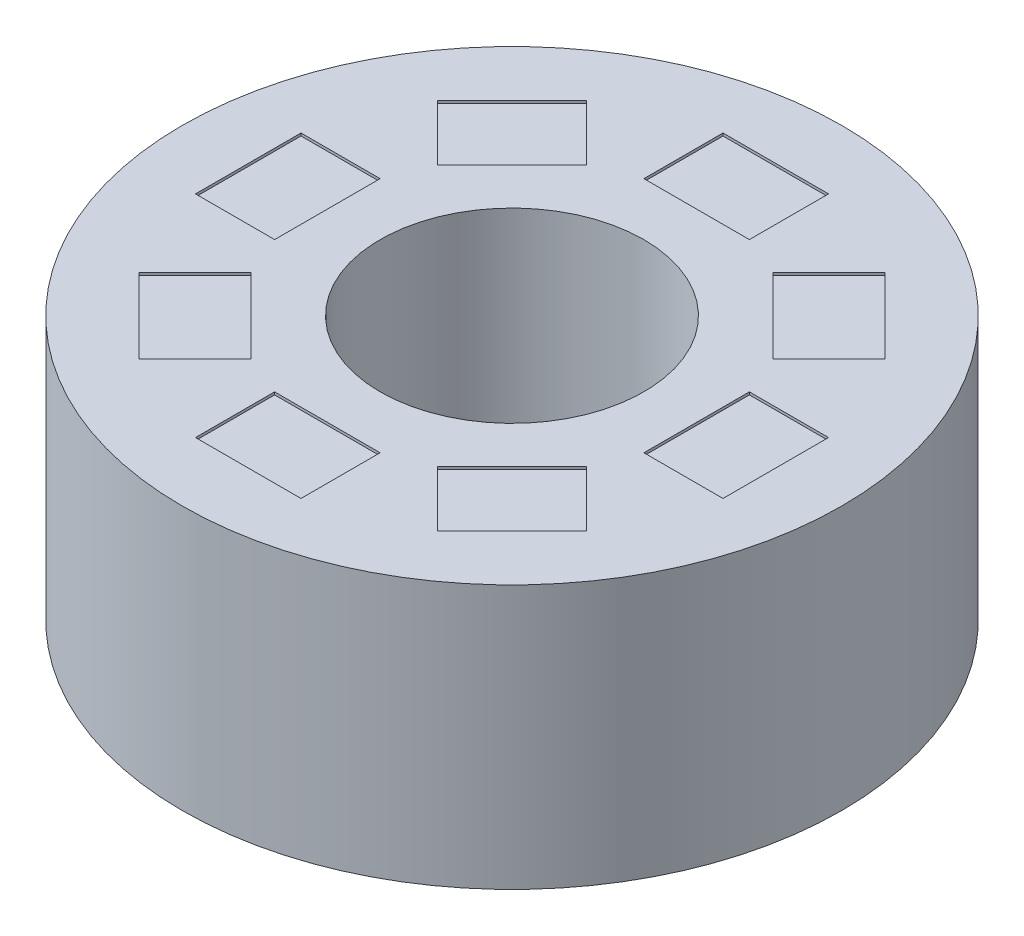
from build123d import *

# Parameters (mm, degrees)
SKETCH1_R           = 125
SKETCH1_R_2         = 50
BOSS_EXTRUDE1_DEPTH = 50
SKETCH2_W           = 40
SKETCH2_H           = 30
CUT_EXTRUDE1_DEPTH  = 1
CIRPATTERN1_COUNT   = 8


with BuildPart() as part:
    # Sketch1 → Boss-Extrude1 (new, symmetric)
    with BuildSketch(Plane(origin=(0, 0, 0), x_dir=(1, 0, 0), z_dir=(0, 1, 0))):
        with Locations(Location((0, 0, 0), (0, 0, 270))):
            Circle(SKETCH1_R)
        with Locations(Location((0, 0, 0), (0, 0, 270))):
            Circle(SKETCH1_R_2, mode=Mode.SUBTRACT)
    extrude(amount=BOSS_EXTRUDE1_DEPTH, both=True)

    # Sketch2 → Cut-Extrude1 (cut)
    with BuildSketch(Plane(origin=(0, 50, 0), x_dir=(1, 0, 0), z_dir=(0, 1, 0))):
        with Locations((0, 85)):
            Rectangle(SKETCH2_W, SKETCH2_H)
    cut_extrude1 = extrude(amount=-CUT_EXTRUDE1_DEPTH, mode=Mode.SUBTRACT)

    # CirPattern1: Cut-Extrude1 ×8 about axis
    cirpattern1_axis = Axis((0, 0, 0), (0, 1, 0))
    for i in range(1, CIRPATTERN1_COUNT):
        add(cut_extrude1.rotate(cirpattern1_axis, i * 360 / CIRPATTERN1_COUNT), mode=Mode.SUBTRACT)


solid = part.part
